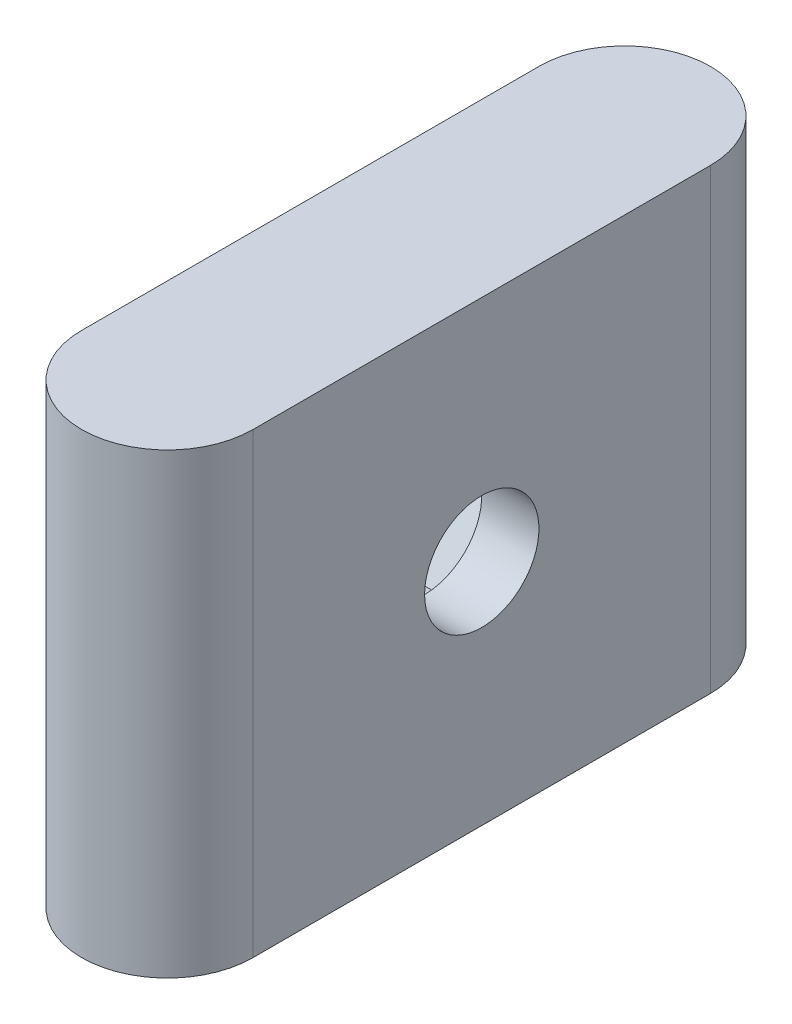
from build123d import *

# Parameters (mm, degrees)
BOSS_EXTRUDE1_DEPTH = 20
SKETCH2_R           = 2.5
CUT_EXTRUDE1_DEPTH  = 20
SKETCH2_4_R         = 2.5
CUT_EXTRUDE2_DEPTH  = 5


with BuildPart() as part:
    # Sketch1 → Boss-Extrude1 (new body)
    with BuildSketch(Plane(origin=(0, 0, 0), x_dir=(1, 0, 0), z_dir=(0, 1, 0))):
        with BuildLine():
            Line((-3.75, -8.45729612), (-3.75, 11.54270388))
            ThreePointArc((-3.75, 11.54270388), (0, 15.29270388), (3.75, 11.54270388))
            Line((3.75, 11.54270388), (3.75, -8.45729612))
            ThreePointArc((3.75, -8.45729612), (0, -12.20729612), (-3.75, -8.45729612))
        make_face()
    extrude(amount=BOSS_EXTRUDE1_DEPTH)

    # Sketch2 → Cut-Extrude1 (cut)
    with BuildSketch(Plane.ZY.offset(3.75)):
        with Locations((-1.54270388, 10)):
            Circle(SKETCH2_R)
    extrude(amount=-CUT_EXTRUDE1_DEPTH, mode=Mode.SUBTRACT)

    # Sketch2<4> → Cut-Extrude2 (cut)
    with BuildSketch(Plane.ZY.offset(3.75)):
        Polygon((4.402095487, 10), (1.429695804, 15.148347272), (-4.515103563, 15.148347272), (-7.487503247, 10), (-4.515103563, 4.851652728), (1.429695804, 4.851652728), align=None)
        with Locations((-1.54270388, 10)):
            Circle(SKETCH2_4_R, mode=Mode.SUBTRACT)
    extrude(amount=-CUT_EXTRUDE2_DEPTH, mode=Mode.SUBTRACT)


solid = part.part
